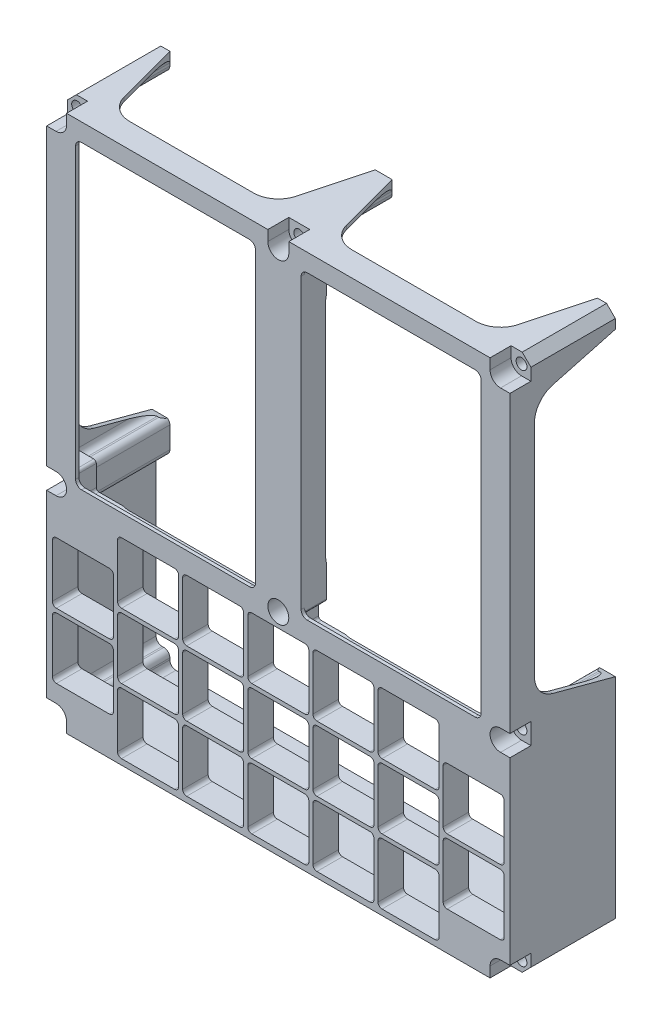
from build123d import *

# Parameters (mm, degrees)
SKETCH1_R                           = 2.0447
MAIN_OULINE_AND_THROUGH_HOLES_DEPTH = 39.8653
SKETCH2_R                           = 3.9624
FRONT_HOLES_FILLET_DEPTH            = 7.9375
SIDE_CUT_DEPTH                      = 272.284997271
SIDE_CUT_DEPTH_BACK                 = 272.284997271
SKETCH5_R                           = 1.583055
CUT_EXTRUDE4_DEPTH                  = 5.08
TOP_CUT_REACH                       = 273.285
CUT_EXTRUDE5_DEPTH                  = 38.5953
CUT_EXTRUDE6_DEPTH                  = 30.2133
CUT_EXTRUDE7_DEPTH                  = 38.3413
FILLET1_R                           = 2.286


with BuildPart() as part:
    # Sketch1 → Main ouline and through holes (new body)
    with BuildSketch(Plane.XY):
        Polygon((0, 199.898), (3.302, 203.2), (171.958, 203.2), (175.26, 199.898), (175.26, 3.302), (171.958, 0), (3.302, 0), (0, 3.302), align=None)
        with Locations((171.704, 3.937)):
            Circle(SKETCH1_R, mode=Mode.SUBTRACT)
        with Locations((171.704, 199.263)):
            Circle(SKETCH1_R, mode=Mode.SUBTRACT)
        with Locations((87.63, 199.263)):
            Circle(SKETCH1_R, mode=Mode.SUBTRACT)
        with Locations((3.556, 199.263)):
            Circle(SKETCH1_R, mode=Mode.SUBTRACT)
        with Locations((3.556, 3.937)):
            Circle(SKETCH1_R, mode=Mode.SUBTRACT)
        with Locations((171.704, 79.883)):
            Circle(SKETCH1_R, mode=Mode.SUBTRACT)
        with Locations((87.63, 79.883)):
            Circle(SKETCH1_R, mode=Mode.SUBTRACT)
        with Locations((3.556, 79.883)):
            Circle(SKETCH1_R, mode=Mode.SUBTRACT)
        with BuildLine():
            Line((123.825, 23.749), (123.825, 3.683))
            ThreePointArc((123.825, 3.683), (123.378630735, 2.605369265), (122.301, 2.159))
            Line((122.301, 2.159), (102.235, 2.159))
            ThreePointArc((102.235, 2.159), (101.157369265, 2.605369265), (100.711, 3.683))
            Line((100.711, 3.683), (100.711, 23.749))
            ThreePointArc((100.711, 23.749), (101.157369265, 24.826630735), (102.235, 25.273))
            Line((102.235, 25.273), (122.301, 25.273))
            ThreePointArc((122.301, 25.273), (123.378630735, 24.826630735), (123.825, 23.749))
        make_face(mode=Mode.SUBTRACT)
        with BuildLine():
            Line((76.708, 196.469), (13.208, 196.469))
            ThreePointArc((13.208, 196.469), (11.591553898, 195.799446102), (10.922, 194.183))
            Line((10.922, 194.183), (10.922, 84.963))
            ThreePointArc((10.922, 84.963), (11.591553898, 83.346553898), (13.208, 82.677))
            Line((13.208, 82.677), (76.708, 82.677))
            ThreePointArc((76.708, 82.677), (78.324446102, 83.346553898), (78.994, 84.963))
            Line((78.994, 84.963), (78.994, 194.183))
            ThreePointArc((78.994, 194.183), (78.324446102, 195.799446102), (76.708, 196.469))
        make_face(mode=Mode.SUBTRACT)
        with BuildLine():
            Line((162.052, 196.469), (98.552, 196.469))
            ThreePointArc((98.552, 196.469), (96.935553898, 195.799446102), (96.266, 194.183))
            Line((96.266, 194.183), (96.266, 84.963))
            ThreePointArc((96.266, 84.963), (96.935553898, 83.346553898), (98.552, 82.677))
            Line((98.552, 82.677), (162.052, 82.677))
            ThreePointArc((162.052, 82.677), (163.668446102, 83.346553898), (164.338, 84.963))
            Line((164.338, 84.963), (164.338, 194.183))
            ThreePointArc((164.338, 194.183), (163.668446102, 195.799446102), (162.052, 196.469))
        make_face(mode=Mode.SUBTRACT)
        with BuildLine():
            Line((146.939, 25.273), (126.873, 25.273))
            ThreePointArc((126.873, 25.273), (125.795369265, 24.826630735), (125.349, 23.749))
            Line((125.349, 23.749), (125.349, 3.683))
            ThreePointArc((125.349, 3.683), (125.795369265, 2.605369265), (126.873, 2.159))
            Line((126.873, 2.159), (146.939, 2.159))
            ThreePointArc((146.939, 2.159), (148.016630735, 2.605369265), (148.463, 3.683))
            Line((148.463, 3.683), (148.463, 23.749))
            ThreePointArc((148.463, 23.749), (148.016630735, 24.826630735), (146.939, 25.273))
        make_face(mode=Mode.SUBTRACT)
        with BuildLine():
            Line((99.187, 23.749), (99.187, 3.683))
            ThreePointArc((99.187, 3.683), (98.740630735, 2.605369265), (97.663, 2.159))
            Line((97.663, 2.159), (77.597, 2.159))
            ThreePointArc((77.597, 2.159), (76.519369265, 2.605369265), (76.073, 3.683))
            Line((76.073, 3.683), (76.073, 23.749))
            ThreePointArc((76.073, 23.749), (76.519369265, 24.826630735), (77.597, 25.273))
            Line((77.597, 25.273), (97.663, 25.273))
            ThreePointArc((97.663, 25.273), (98.740630735, 24.826630735), (99.187, 23.749))
        make_face(mode=Mode.SUBTRACT)
        with BuildLine():
            Line((74.549, 23.749), (74.549, 3.683))
            ThreePointArc((74.549, 3.683), (74.102630735, 2.605369265), (73.025, 2.159))
            Line((73.025, 2.159), (52.959, 2.159))
            ThreePointArc((52.959, 2.159), (51.881369265, 2.605369265), (51.435, 3.683))
            Line((51.435, 3.683), (51.435, 23.749))
            ThreePointArc((51.435, 23.749), (51.881369265, 24.826630735), (52.959, 25.273))
            Line((52.959, 25.273), (73.025, 25.273))
            ThreePointArc((73.025, 25.273), (74.102630735, 24.826630735), (74.549, 23.749))
        make_face(mode=Mode.SUBTRACT)
        with BuildLine():
            Line((49.911, 23.749), (49.911, 3.683))
            ThreePointArc((49.911, 3.683), (49.464630735, 2.605369265), (48.387, 2.159))
            Line((48.387, 2.159), (28.321, 2.159))
            ThreePointArc((28.321, 2.159), (27.243369265, 2.605369265), (26.797, 3.683))
            Line((26.797, 3.683), (26.797, 23.749))
            ThreePointArc((26.797, 23.749), (27.243369265, 24.826630735), (28.321, 25.273))
            Line((28.321, 25.273), (48.387, 25.273))
            ThreePointArc((48.387, 25.273), (49.464630735, 24.826630735), (49.911, 23.749))
        make_face(mode=Mode.SUBTRACT)
        with BuildLine():
            Line((123.825, 48.387), (123.825, 28.321))
            ThreePointArc((123.825, 28.321), (123.378630735, 27.243369265), (122.301, 26.797))
            Line((122.301, 26.797), (102.235, 26.797))
            ThreePointArc((102.235, 26.797), (101.157369265, 27.243369265), (100.711, 28.321))
            Line((100.711, 28.321), (100.711, 48.387))
            ThreePointArc((100.711, 48.387), (101.157369265, 49.464630735), (102.235, 49.911))
            Line((102.235, 49.911), (122.301, 49.911))
            ThreePointArc((122.301, 49.911), (123.378630735, 49.464630735), (123.825, 48.387))
        make_face(mode=Mode.SUBTRACT)
        with BuildLine():
            Line((99.187, 48.387), (99.187, 28.321))
            ThreePointArc((99.187, 28.321), (98.740630735, 27.243369265), (97.663, 26.797))
            Line((97.663, 26.797), (77.597, 26.797))
            ThreePointArc((77.597, 26.797), (76.519369265, 27.243369265), (76.073, 28.321))
            Line((76.073, 28.321), (76.073, 48.387))
            ThreePointArc((76.073, 48.387), (76.519369265, 49.464630735), (77.597, 49.911))
            Line((77.597, 49.911), (97.663, 49.911))
            ThreePointArc((97.663, 49.911), (98.740630735, 49.464630735), (99.187, 48.387))
        make_face(mode=Mode.SUBTRACT)
        with BuildLine():
            Line((74.549, 48.387), (74.549, 28.321))
            ThreePointArc((74.549, 28.321), (74.102630735, 27.243369265), (73.025, 26.797))
            Line((73.025, 26.797), (52.959, 26.797))
            ThreePointArc((52.959, 26.797), (51.881369265, 27.243369265), (51.435, 28.321))
            Line((51.435, 28.321), (51.435, 48.387))
            ThreePointArc((51.435, 48.387), (51.881369265, 49.464630735), (52.959, 49.911))
            Line((52.959, 49.911), (73.025, 49.911))
            ThreePointArc((73.025, 49.911), (74.102630735, 49.464630735), (74.549, 48.387))
        make_face(mode=Mode.SUBTRACT)
        with BuildLine():
            Line((49.911, 48.387), (49.911, 28.321))
            ThreePointArc((49.911, 28.321), (49.464630735, 27.243369265), (48.387, 26.797))
            Line((48.387, 26.797), (28.321, 26.797))
            ThreePointArc((28.321, 26.797), (27.243369265, 27.243369265), (26.797, 28.321))
            Line((26.797, 28.321), (26.797, 48.387))
            ThreePointArc((26.797, 48.387), (27.243369265, 49.464630735), (28.321, 49.911))
            Line((28.321, 49.911), (48.387, 49.911))
            ThreePointArc((48.387, 49.911), (49.464630735, 49.464630735), (49.911, 48.387))
        make_face(mode=Mode.SUBTRACT)
        with BuildLine():
            Line((123.825, 73.025), (123.825, 52.959))
            ThreePointArc((123.825, 52.959), (123.378630735, 51.881369265), (122.301, 51.435))
            Line((122.301, 51.435), (102.235, 51.435))
            ThreePointArc((102.235, 51.435), (101.157369265, 51.881369265), (100.711, 52.959))
            Line((100.711, 52.959), (100.711, 73.025))
            ThreePointArc((100.711, 73.025), (101.157369265, 74.102630735), (102.235, 74.549))
            Line((102.235, 74.549), (122.301, 74.549))
            ThreePointArc((122.301, 74.549), (123.378630735, 74.102630735), (123.825, 73.025))
        make_face(mode=Mode.SUBTRACT)
        with BuildLine():
            Line((99.187, 73.025), (99.187, 52.959))
            ThreePointArc((99.187, 52.959), (98.740630735, 51.881369265), (97.663, 51.435))
            Line((97.663, 51.435), (77.597, 51.435))
            ThreePointArc((77.597, 51.435), (76.519369265, 51.881369265), (76.073, 52.959))
            Line((76.073, 52.959), (76.073, 73.025))
            ThreePointArc((76.073, 73.025), (76.519369265, 74.102630735), (77.597, 74.549))
            Line((77.597, 74.549), (97.663, 74.549))
            ThreePointArc((97.663, 74.549), (98.740630735, 74.102630735), (99.187, 73.025))
        make_face(mode=Mode.SUBTRACT)
        with BuildLine():
            Line((74.549, 73.025), (74.549, 52.959))
            ThreePointArc((74.549, 52.959), (74.102630735, 51.881369265), (73.025, 51.435))
            Line((73.025, 51.435), (52.959, 51.435))
            ThreePointArc((52.959, 51.435), (51.881369265, 51.881369265), (51.435, 52.959))
            Line((51.435, 52.959), (51.435, 73.025))
            ThreePointArc((51.435, 73.025), (51.881369265, 74.102630735), (52.959, 74.549))
            Line((52.959, 74.549), (73.025, 74.549))
            ThreePointArc((73.025, 74.549), (74.102630735, 74.102630735), (74.549, 73.025))
        make_face(mode=Mode.SUBTRACT)
        with BuildLine():
            Line((49.911, 73.025), (49.911, 52.959))
            ThreePointArc((49.911, 52.959), (49.464630735, 51.881369265), (48.387, 51.435))
            Line((48.387, 51.435), (28.321, 51.435))
            ThreePointArc((28.321, 51.435), (27.243369265, 51.881369265), (26.797, 52.959))
            Line((26.797, 52.959), (26.797, 73.025))
            ThreePointArc((26.797, 73.025), (27.243369265, 74.102630735), (28.321, 74.549))
            Line((28.321, 74.549), (48.387, 74.549))
            ThreePointArc((48.387, 74.549), (49.464630735, 74.102630735), (49.911, 73.025))
        make_face(mode=Mode.SUBTRACT)
        with BuildLine():
            Line((148.463, 48.387), (148.463, 28.321))
            ThreePointArc((148.463, 28.321), (148.016630735, 27.243369265), (146.939, 26.797))
            Line((146.939, 26.797), (126.873, 26.797))
            ThreePointArc((126.873, 26.797), (125.795369265, 27.243369265), (125.349, 28.321))
            Line((125.349, 28.321), (125.349, 48.387))
            ThreePointArc((125.349, 48.387), (125.795369265, 49.464630735), (126.873, 49.911))
            Line((126.873, 49.911), (146.939, 49.911))
            ThreePointArc((146.939, 49.911), (148.016630735, 49.464630735), (148.463, 48.387))
        make_face(mode=Mode.SUBTRACT)
        with BuildLine():
            Line((148.463, 73.025), (148.463, 52.959))
            ThreePointArc((148.463, 52.959), (148.016630735, 51.881369265), (146.939, 51.435))
            Line((146.939, 51.435), (126.873, 51.435))
            ThreePointArc((126.873, 51.435), (125.795369265, 51.881369265), (125.349, 52.959))
            Line((125.349, 52.959), (125.349, 73.025))
            ThreePointArc((125.349, 73.025), (125.795369265, 74.102630735), (126.873, 74.549))
            Line((126.873, 74.549), (146.939, 74.549))
            ThreePointArc((146.939, 74.549), (148.016630735, 74.102630735), (148.463, 73.025))
        make_face(mode=Mode.SUBTRACT)
        with BuildLine():
            Line((173.101, 36.068), (173.101, 16.002))
            ThreePointArc((173.101, 16.002), (172.654630735, 14.924369265), (171.577, 14.478))
            Line((171.577, 14.478), (151.511, 14.478))
            ThreePointArc((151.511, 14.478), (150.433369265, 14.924369265), (149.987, 16.002))
            Line((149.987, 16.002), (149.987, 36.068))
            ThreePointArc((149.987, 36.068), (150.433369265, 37.145630735), (151.511, 37.592))
            Line((151.511, 37.592), (171.577, 37.592))
            ThreePointArc((171.577, 37.592), (172.654630735, 37.145630735), (173.101, 36.068))
        make_face(mode=Mode.SUBTRACT)
        with BuildLine():
            Line((23.749, 37.592), (3.683, 37.592))
            ThreePointArc((3.683, 37.592), (2.605369265, 37.145630735), (2.159, 36.068))
            Line((2.159, 36.068), (2.159, 16.002))
            ThreePointArc((2.159, 16.002), (2.605369265, 14.924369265), (3.683, 14.478))
            Line((3.683, 14.478), (23.749, 14.478))
            ThreePointArc((23.749, 14.478), (24.826630735, 14.924369265), (25.273, 16.002))
            Line((25.273, 16.002), (25.273, 36.068))
            ThreePointArc((25.273, 36.068), (24.826630735, 37.145630735), (23.749, 37.592))
        make_face(mode=Mode.SUBTRACT)
        with BuildLine():
            Line((173.101, 60.706), (173.101, 40.64))
            ThreePointArc((173.101, 40.64), (172.654630735, 39.562369265), (171.577, 39.116))
            Line((171.577, 39.116), (151.511, 39.116))
            ThreePointArc((151.511, 39.116), (150.433369265, 39.562369265), (149.987, 40.64))
            Line((149.987, 40.64), (149.987, 60.706))
            ThreePointArc((149.987, 60.706), (150.433369265, 61.783630735), (151.511, 62.23))
            Line((151.511, 62.23), (171.577, 62.23))
            ThreePointArc((171.577, 62.23), (172.654630735, 61.783630735), (173.101, 60.706))
        make_face(mode=Mode.SUBTRACT)
        with BuildLine():
            Line((25.273, 60.706), (25.273, 40.64))
            ThreePointArc((25.273, 40.64), (24.826630735, 39.562369265), (23.749, 39.116))
            Line((23.749, 39.116), (3.683, 39.116))
            ThreePointArc((3.683, 39.116), (2.605369265, 39.562369265), (2.159, 40.64))
            Line((2.159, 40.64), (2.159, 60.706))
            ThreePointArc((2.159, 60.706), (2.605369265, 61.783630735), (3.683, 62.23))
            Line((3.683, 62.23), (23.749, 62.23))
            ThreePointArc((23.749, 62.23), (24.826630735, 61.783630735), (25.273, 60.706))
        make_face(mode=Mode.SUBTRACT)
    extrude(amount=MAIN_OULINE_AND_THROUGH_HOLES_DEPTH)

    # Sketch2 → Front holes fillet (cut)
    with BuildSketch(Plane.XY.offset(39.8653)):
        with Locations((87.63, 79.883)):
            Circle(SKETCH2_R)
        with BuildLine():
            Line((0, 83.8454), (3.556, 83.8454))
            ThreePointArc((3.556, 83.8454), (7.5184, 79.883), (3.556, 75.9206))
            Line((3.556, 75.9206), (0, 75.9206))
            Line((0, 75.9206), (0, 83.8454))
        make_face()
        with BuildLine():
            Line((7.5184, 203.2), (7.5184, 199.263))
            ThreePointArc((7.5184, 199.263), (6.35783991, 196.46116009), (3.556, 195.3006))
            Line((3.556, 195.3006), (0, 195.3006))
            Line((0, 195.3006), (0, 203.2))
            Line((0, 203.2), (7.5184, 203.2))
        make_face()
        with BuildLine():
            Line((0, 7.8994), (3.556, 7.8994))
            ThreePointArc((3.556, 7.8994), (6.35783991, 6.73883991), (7.5184, 3.937))
            Line((7.5184, 3.937), (7.5184, 0))
            Line((7.5184, 0), (0, 0))
            Line((0, 0), (0, 7.8994))
        make_face()
        with BuildLine():
            Line((175.26, 0), (167.7416, 0))
            Line((167.7416, 0), (167.7416, 3.937))
            ThreePointArc((167.7416, 3.937), (168.90216009, 6.73883991), (171.704, 7.8994))
            Line((171.704, 7.8994), (175.26, 7.8994))
            Line((175.26, 7.8994), (175.26, 0))
        make_face()
        with BuildLine():
            Line((175.26, 203.2), (175.26, 195.3006))
            Line((175.26, 195.3006), (171.704, 195.3006))
            ThreePointArc((171.704, 195.3006), (168.90216009, 196.46116009), (167.7416, 199.263))
            Line((167.7416, 199.263), (167.7416, 203.2))
            Line((167.7416, 203.2), (175.26, 203.2))
        make_face()
        with BuildLine():
            Line((175.26, 83.8454), (175.26, 75.9206))
            Line((175.26, 75.9206), (171.704, 75.9206))
            ThreePointArc((171.704, 75.9206), (167.7416, 79.883), (171.704, 83.8454))
            Line((171.704, 83.8454), (175.26, 83.8454))
        make_face()
        with BuildLine():
            Line((83.6676, 203.2), (83.6676, 199.263))
            ThreePointArc((83.6676, 199.263), (87.63, 195.3006), (91.5924, 199.263))
            Line((91.5924, 199.263), (91.5924, 203.2))
            Line((91.5924, 203.2), (83.6676, 203.2))
        make_face()
    extrude(amount=-FRONT_HOLES_FILLET_DEPTH, mode=Mode.SUBTRACT)

    # Sketch3 → Side Cut (cut, two sides: drawn at the far end of the back side and taken through both)
    with BuildSketch(Plane(origin=(175.26, 0, 0), x_dir=(0, 0, -1), z_dir=(1, 0, 0)).offset(-SIDE_CUT_DEPTH_BACK)):
        with BuildLine():
            Line((396.70236494, 302.638078321), (0, 196.342))
            Line((0, 196.342), (-23.641381386, 190.00731095))
            ThreePointArc((-23.641381386, 190.00731095), (-28.664934692, 186.650679944), (-30.607, 180.929540034))
            Line((-30.607, 180.929540034), (-30.607, 97.962459966))
            ThreePointArc((-30.607, 97.962459966), (-28.664934692, 92.241320056), (-23.641381386, 88.88468905))
            Line((-23.641381386, 88.88468905), (0, 82.55))
            Line((0, 82.55), (396.70236494, -23.746078321))
            Line((396.70236494, -23.746078321), (1218.095383208, -23.746078321))
            Line((1218.095383208, -23.746078321), (1218.095383208, 302.638078321))
            Line((1218.095383208, 302.638078321), (396.70236494, 302.638078321))
        make_face()
    extrude(amount=SIDE_CUT_DEPTH + SIDE_CUT_DEPTH_BACK, mode=Mode.SUBTRACT)

    # Sketch5 → Cut-Extrude4 (cut)
    with BuildSketch(Plane(origin=(0, 0, 0), x_dir=(-1, 0, 0), z_dir=(0, 0, -1))):
        with Locations((-171.704, 73.533)):
            Circle(SKETCH5_R)
        with Locations((-3.556, 73.533)):
            Circle(SKETCH5_R)
    extrude(amount=-CUT_EXTRUDE4_DEPTH, mode=Mode.SUBTRACT)

    # Top Cut: up to this face of the body (flat: up to its plane)
    top_cut_end = Plane(part.part.faces().sort_by_distance((87.63, 74.549, 19.93265))[0])
    # Sketch4 → Top Cut (cut, up to the picked face)
    with BuildSketch(Plane(origin=(0, 203.2, 0), x_dir=(1, 0, 0), z_dir=(0, 1, 0)), mode=Mode.PRIVATE) as top_cut_sk1:
        with BuildLine():
            Line((6.731, 0), (13.06568905, -23.641381386))
            ThreePointArc((13.06568905, -23.641381386), (16.422320056, -28.664934692), (22.143459966, -30.607))
            Line((22.143459966, -30.607), (69.042540034, -30.607))
            ThreePointArc((69.042540034, -30.607), (74.763679944, -28.664934692), (78.12031095, -23.641381386))
            Line((78.12031095, -23.641381386), (84.455, 0))
            Line((84.455, 0), (6.731, 0))
        make_face()
    top_cut_tool1 = split(extrude(top_cut_sk1.sketch, amount=-TOP_CUT_REACH, mode=Mode.PRIVATE), bisect_by=top_cut_end, keep=Keep.BOTH, mode=Mode.PRIVATE)
    # Sketch4 → Top Cut (cut, up to the picked face)
    with BuildSketch(Plane(origin=(0, 203.2, 0), x_dir=(1, 0, 0), z_dir=(0, 1, 0)), mode=Mode.PRIVATE) as top_cut_sk2:
        with BuildLine():
            Line((168.529, 0), (162.19431095, -23.641381386))
            ThreePointArc((162.19431095, -23.641381386), (158.837679944, -28.664934692), (153.116540034, -30.607))
            Line((153.116540034, -30.607), (106.217459966, -30.607))
            ThreePointArc((106.217459966, -30.607), (100.496320056, -28.664934692), (97.13968905, -23.641381386))
            Line((97.13968905, -23.641381386), (90.805, 0))
            Line((90.805, 0), (168.529, 0))
        make_face()
    top_cut_tool2 = split(extrude(top_cut_sk2.sketch, amount=-TOP_CUT_REACH, mode=Mode.PRIVATE), bisect_by=top_cut_end, keep=Keep.BOTH, mode=Mode.PRIVATE)
    add(top_cut_tool1.solids().sort_by(Axis((45.593, 203.2, 14.565576), (0, -1, 0)))[0], mode=Mode.SUBTRACT)
    add(top_cut_tool2.solids().sort_by(Axis((129.667, 203.2, 14.565576), (0, -1, 0)))[0], mode=Mode.SUBTRACT)

    # Sketch6 → Cut-Extrude5 (cut)
    with BuildSketch(Plane(origin=(0, 0, 0), x_dir=(-1, 0, 0), z_dir=(0, 0, -1))):
        with BuildLine():
            Line((-94.183665192, 201.676), (-165.150334808, 201.676))
            ThreePointArc((-165.150334808, 201.676), (-165.851123726, 201.385723726), (-166.1414, 200.684934808))
            Line((-166.1414, 200.684934808), (-166.1414, 194.691465192))
            ThreePointArc((-166.1414, 194.691465192), (-166.431676274, 193.990676274), (-167.132465192, 193.7004))
            Line((-167.132465192, 193.7004), (-172.744934808, 193.7004))
            ThreePointArc((-172.744934808, 193.7004), (-173.445723726, 193.410123726), (-173.736, 192.709334808))
            Line((-173.736, 192.709334808), (-173.736, 86.436665192))
            ThreePointArc((-173.736, 86.436665192), (-173.445723726, 85.735876274), (-172.744934808, 85.4456))
            Line((-172.744934808, 85.4456), (-167.132465192, 85.4456))
            ThreePointArc((-167.132465192, 85.4456), (-166.431676274, 85.155323726), (-166.1414, 84.454534808))
            Line((-166.1414, 84.454534808), (-166.1414, 76.556065192))
            ThreePointArc((-166.1414, 76.556065192), (-165.851123726, 75.855276274), (-165.150334808, 75.565))
            Line((-165.150334808, 75.565), (-94.183665192, 75.565))
            ThreePointArc((-94.183665192, 75.565), (-93.482876274, 75.855276274), (-93.1926, 76.556065192))
            Line((-93.1926, 76.556065192), (-93.1926, 81.685934808))
            ThreePointArc((-93.1926, 81.685934808), (-93.482876274, 82.386723726), (-94.183665192, 82.677))
            Line((-94.183665192, 82.677), (-95.274934808, 82.677))
            ThreePointArc((-95.274934808, 82.677), (-95.975723726, 82.967276274), (-96.266, 83.668065192))
            Line((-96.266, 83.668065192), (-96.266, 195.477934808))
            ThreePointArc((-96.266, 195.477934808), (-95.975723726, 196.178723726), (-95.274934808, 196.469))
            Line((-95.274934808, 196.469), (-94.183665192, 196.469))
            ThreePointArc((-94.183665192, 196.469), (-93.482876274, 196.759276274), (-93.1926, 197.460065192))
            Line((-93.1926, 197.460065192), (-93.1926, 200.684934808))
            ThreePointArc((-93.1926, 200.684934808), (-93.482876274, 201.385723726), (-94.183665192, 201.676))
        make_face()
        with BuildLine():
            Line((-82.0674, 81.685934808), (-82.0674, 76.556065192))
            ThreePointArc((-82.0674, 76.556065192), (-81.777123726, 75.855276274), (-81.076334808, 75.565))
            Line((-81.076334808, 75.565), (-10.109665192, 75.565))
            ThreePointArc((-10.109665192, 75.565), (-9.408876274, 75.855276274), (-9.1186, 76.556065192))
            Line((-9.1186, 76.556065192), (-9.1186, 84.454534808))
            ThreePointArc((-9.1186, 84.454534808), (-8.828323726, 85.155323726), (-8.127534808, 85.4456))
            Line((-8.127534808, 85.4456), (-2.515065192, 85.4456))
            ThreePointArc((-2.515065192, 85.4456), (-1.814276274, 85.735876274), (-1.524, 86.436665192))
            Line((-1.524, 86.436665192), (-1.524, 192.709334808))
            ThreePointArc((-1.524, 192.709334808), (-1.814276274, 193.410123726), (-2.515065192, 193.7004))
            Line((-2.515065192, 193.7004), (-8.127534808, 193.7004))
            ThreePointArc((-8.127534808, 193.7004), (-8.828323726, 193.990676274), (-9.1186, 194.691465192))
            Line((-9.1186, 194.691465192), (-9.1186, 200.684934808))
            ThreePointArc((-9.1186, 200.684934808), (-9.408876274, 201.385723726), (-10.109665192, 201.676))
            Line((-10.109665192, 201.676), (-81.076334808, 201.676))
            ThreePointArc((-81.076334808, 201.676), (-81.777123726, 201.385723726), (-82.0674, 200.684934808))
            Line((-82.0674, 200.684934808), (-82.0674, 197.460065192))
            ThreePointArc((-82.0674, 197.460065192), (-81.777123726, 196.759276274), (-81.076334808, 196.469))
            Line((-81.076334808, 196.469), (-79.985065192, 196.469))
            ThreePointArc((-79.985065192, 196.469), (-79.284276274, 196.178723726), (-78.994, 195.477934808))
            Line((-78.994, 195.477934808), (-78.994, 83.668065192))
            ThreePointArc((-78.994, 83.668065192), (-79.284276274, 82.967276274), (-79.985065192, 82.677))
            Line((-79.985065192, 82.677), (-81.076334808, 82.677))
            ThreePointArc((-81.076334808, 82.677), (-81.777123726, 82.386723726), (-82.0674, 81.685934808))
        make_face()
        with BuildLine():
            Line((-87.63, 193.7004), (-92.463259526, 193.7004))
            ThreePointArc((-92.463259526, 193.7004), (-94.074572368, 193.032972368), (-94.742, 191.421659526))
            Line((-94.742, 191.421659526), (-94.742, 87.724340474))
            ThreePointArc((-94.742, 87.724340474), (-94.074572368, 86.113027632), (-92.463259526, 85.4456))
            Line((-92.463259526, 85.4456), (-87.63, 85.4456))
            Line((-87.63, 85.4456), (-82.796740474, 85.4456))
            ThreePointArc((-82.796740474, 85.4456), (-81.185427632, 86.113027632), (-80.518, 87.724340474))
            Line((-80.518, 87.724340474), (-80.518, 191.421659526))
            ThreePointArc((-80.518, 191.421659526), (-81.185427632, 193.032972368), (-82.796740474, 193.7004))
            Line((-82.796740474, 193.7004), (-87.63, 193.7004))
        make_face()
    extrude(amount=-CUT_EXTRUDE5_DEPTH, mode=Mode.SUBTRACT)

    # Sketch8 → Cut-Extrude6 (cut)
    with BuildSketch(Plane(origin=(0, 0, 0), x_dir=(-1, 0, 0), z_dir=(0, 0, -1))):
        with BuildLine():
            Line((-168.529, 72.644), (-168.529, 80.772))
            ThreePointArc((-168.529, 80.772), (-169.198553898, 82.388446102), (-170.815, 83.058))
            Line((-170.815, 83.058), (-171.45, 83.058))
            ThreePointArc((-171.45, 83.058), (-173.066446102, 83.727553898), (-173.736, 85.344))
            Line((-173.736, 85.344), (-173.736, 193.802))
            ThreePointArc((-173.736, 193.802), (-173.066446102, 195.418446102), (-171.45, 196.088))
            Line((-171.45, 196.088), (-170.815, 196.088))
            ThreePointArc((-170.815, 196.088), (-169.198553898, 196.757553898), (-168.529, 198.374))
            Line((-168.529, 198.374), (-168.529, 199.39))
            ThreePointArc((-168.529, 199.39), (-167.859446102, 201.006446102), (-166.243, 201.676))
            Line((-166.243, 201.676), (-93.091, 201.676))
            ThreePointArc((-93.091, 201.676), (-91.474553898, 201.006446102), (-90.805, 199.39))
            Line((-90.805, 199.39), (-90.805, 198.374))
            ThreePointArc((-90.805, 198.374), (-90.135446102, 196.757553898), (-88.519, 196.088))
            Line((-88.519, 196.088), (-86.741, 196.088))
            ThreePointArc((-86.741, 196.088), (-85.124553898, 196.757553898), (-84.455, 198.374))
            Line((-84.455, 198.374), (-84.455, 199.39))
            ThreePointArc((-84.455, 199.39), (-83.785446102, 201.006446102), (-82.169, 201.676))
            Line((-82.169, 201.676), (-9.017, 201.676))
            ThreePointArc((-9.017, 201.676), (-7.400553898, 201.006446102), (-6.731, 199.39))
            Line((-6.731, 199.39), (-6.731, 198.374))
            ThreePointArc((-6.731, 198.374), (-6.061446102, 196.757553898), (-4.445, 196.088))
            Line((-4.445, 196.088), (-3.81, 196.088))
            ThreePointArc((-3.81, 196.088), (-2.193553898, 195.418446102), (-1.524, 193.802))
            Line((-1.524, 193.802), (-1.524, 85.344))
            ThreePointArc((-1.524, 85.344), (-2.193553898, 83.727553898), (-3.81, 83.058))
            Line((-3.81, 83.058), (-4.445, 83.058))
            ThreePointArc((-4.445, 83.058), (-6.061446102, 82.388446102), (-6.731, 80.772))
            Line((-6.731, 80.772), (-6.731, 72.644))
            ThreePointArc((-6.731, 72.644), (-6.061446102, 71.027553898), (-4.445, 70.358))
            Line((-4.445, 70.358), (-3.81, 70.358))
            ThreePointArc((-3.81, 70.358), (-2.193553898, 69.688446102), (-1.524, 68.072))
            Line((-1.524, 68.072), (-1.524, 9.017))
            ThreePointArc((-1.524, 9.017), (-2.193553898, 7.400553898), (-3.81, 6.731))
            Line((-3.81, 6.731), (-4.445, 6.731))
            ThreePointArc((-4.445, 6.731), (-6.061446102, 6.061446102), (-6.731, 4.445))
            Line((-6.731, 4.445), (-6.731, 3.81))
            ThreePointArc((-6.731, 3.81), (-7.400553898, 2.193553898), (-9.017, 1.524))
            Line((-9.017, 1.524), (-166.243, 1.524))
            ThreePointArc((-166.243, 1.524), (-167.859446102, 2.193553898), (-168.529, 3.81))
            Line((-168.529, 3.81), (-168.529, 4.445))
            ThreePointArc((-168.529, 4.445), (-169.198553898, 6.061446102), (-170.815, 6.731))
            Line((-170.815, 6.731), (-171.45, 6.731))
            ThreePointArc((-171.45, 6.731), (-173.066446102, 7.400553898), (-173.736, 9.017))
            Line((-173.736, 9.017), (-173.736, 68.072))
            ThreePointArc((-173.736, 68.072), (-173.066446102, 69.688446102), (-171.45, 70.358))
            Line((-171.45, 70.358), (-170.815, 70.358))
            ThreePointArc((-170.815, 70.358), (-169.198553898, 71.027553898), (-168.529, 72.644))
        make_face()
    extrude(amount=-CUT_EXTRUDE6_DEPTH, mode=Mode.SUBTRACT)

    # Sketch9 → Cut-Extrude7 (cut)
    with BuildSketch(Plane(origin=(0, 0, 0), x_dir=(-1, 0, 0), z_dir=(0, 0, -1))):
        with BuildLine():
            Line((-166.243, 74.549), (-152.273, 74.549))
            ThreePointArc((-152.273, 74.549), (-150.656553898, 73.879446102), (-149.987, 72.263))
            Line((-149.987, 72.263), (-149.987, 67.183))
            ThreePointArc((-149.987, 67.183), (-150.656553898, 65.566553898), (-152.273, 64.897))
            Line((-152.273, 64.897), (-166.243, 64.897))
            ThreePointArc((-166.243, 64.897), (-167.859446102, 65.566553898), (-168.529, 67.183))
            Line((-168.529, 67.183), (-168.529, 72.263))
            ThreePointArc((-168.529, 72.263), (-167.859446102, 73.879446102), (-166.243, 74.549))
        make_face()
        with BuildLine():
            Line((-162.941, 12.573), (-152.273, 12.573))
            ThreePointArc((-152.273, 12.573), (-150.656553898, 11.903446102), (-149.987, 10.287))
            Line((-149.987, 10.287), (-149.987, 4.445))
            ThreePointArc((-149.987, 4.445), (-150.656553898, 2.828553898), (-152.273, 2.159))
            Line((-152.273, 2.159), (-162.941, 2.159))
            ThreePointArc((-162.941, 2.159), (-164.557446102, 2.828553898), (-165.227, 4.445))
            Line((-165.227, 4.445), (-165.227, 10.287))
            ThreePointArc((-165.227, 10.287), (-164.557446102, 11.903446102), (-162.941, 12.573))
        make_face()
        with BuildLine():
            Line((-22.987, 74.549), (-9.017, 74.549))
            ThreePointArc((-9.017, 74.549), (-7.400553898, 73.879446102), (-6.731, 72.263))
            Line((-6.731, 72.263), (-6.731, 67.183))
            ThreePointArc((-6.731, 67.183), (-7.400553898, 65.566553898), (-9.017, 64.897))
            Line((-9.017, 64.897), (-22.987, 64.897))
            ThreePointArc((-22.987, 64.897), (-24.603446102, 65.566553898), (-25.273, 67.183))
            Line((-25.273, 67.183), (-25.273, 72.263))
            ThreePointArc((-25.273, 72.263), (-24.603446102, 73.879446102), (-22.987, 74.549))
        make_face()
        with BuildLine():
            Line((-22.987, 12.573), (-12.319, 12.573))
            ThreePointArc((-12.319, 12.573), (-10.702553898, 11.903446102), (-10.033, 10.287))
            Line((-10.033, 10.287), (-10.033, 4.445))
            ThreePointArc((-10.033, 4.445), (-10.702553898, 2.828553898), (-12.319, 2.159))
            Line((-12.319, 2.159), (-22.987, 2.159))
            ThreePointArc((-22.987, 2.159), (-24.603446102, 2.828553898), (-25.273, 4.445))
            Line((-25.273, 4.445), (-25.273, 10.287))
            ThreePointArc((-25.273, 10.287), (-24.603446102, 11.903446102), (-22.987, 12.573))
        make_face()
    extrude(amount=-CUT_EXTRUDE7_DEPTH, mode=Mode.SUBTRACT)

    # Fillet1
    fillet1_edges = [part.edges().sort_by_distance(p)[0] for p in [
        (7.400553898, 65.566553898, 38.3413),
        (16.002, 64.897, 38.3413),
        (24.603446102, 65.566553898, 38.3413),
        (25.273, 69.723, 38.3413),
        (24.603446102, 73.879446102, 38.3413),
        (16.002, 74.549, 38.3413),
        (7.400553898, 73.879446102, 38.3413),
        (6.731, 69.723, 38.3413),
        (150.656553898, 2.828553898, 38.3413),
        (157.607, 2.159, 38.3413),
        (164.557446102, 2.828553898, 38.3413),
        (165.227, 7.366, 38.3413),
        (164.557446102, 11.903446102, 38.3413),
        (157.607, 12.573, 38.3413),
        (150.656553898, 11.903446102, 38.3413),
        (149.987, 7.366, 38.3413),
        (167.859446102, 65.566553898, 38.3413),
        (168.529, 69.723, 38.3413),
        (167.859446102, 73.879446102, 38.3413),
        (159.258, 74.549, 38.3413),
        (150.656553898, 73.879446102, 38.3413),
        (149.987, 69.723, 38.3413),
        (150.656553898, 65.566553898, 38.3413),
        (159.258, 64.897, 38.3413),
        (24.603446102, 2.828553898, 38.3413),
        (25.273, 7.366, 38.3413),
        (24.603446102, 11.903446102, 38.3413),
        (17.653, 12.573, 38.3413),
        (10.702553898, 11.903446102, 38.3413),
        (10.033, 7.366, 38.3413),
        (10.702553898, 2.828553898, 38.3413),
        (17.653, 2.159, 38.3413),
    ]]
    fillet(fillet1_edges, radius=FILLET1_R)


solid = part.part
